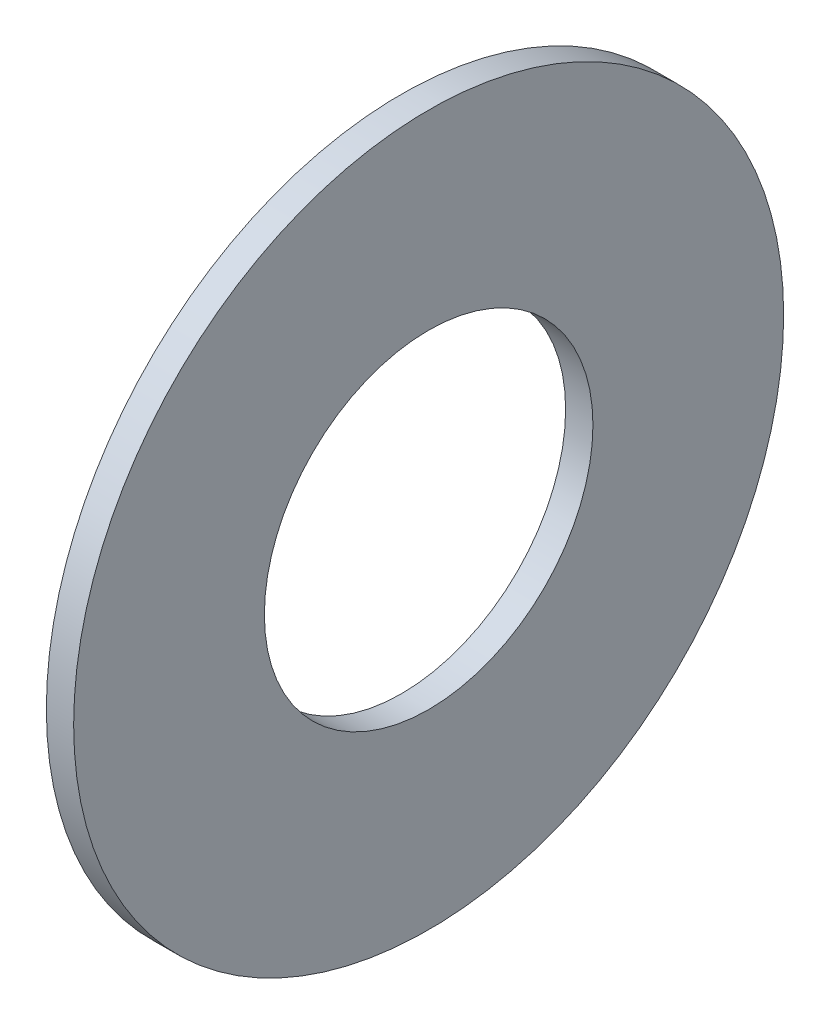
from build123d import *

# Parameters (mm, degrees)
BOSS_EXTRUDE1_DEPTH      = 0.5
BOSS_EXTRUDE1_DEPTH_BACK = 0.5
SKETCH3_R                = 13
SKETCH3_R_2              = 6.016


with BuildPart() as part:
    # Sketch3 → Boss-Extrude1 (new, two sides: drawn at the far end of the back side and taken through both)
    with BuildSketch(Plane(origin=(0, 0, 0), x_dir=(0, 0, -1), z_dir=(1, 0, 0)).offset(-BOSS_EXTRUDE1_DEPTH_BACK)):
        Circle(SKETCH3_R)
        Circle(SKETCH3_R_2, mode=Mode.SUBTRACT)
    extrude(amount=BOSS_EXTRUDE1_DEPTH + BOSS_EXTRUDE1_DEPTH_BACK)


solid = part.part
